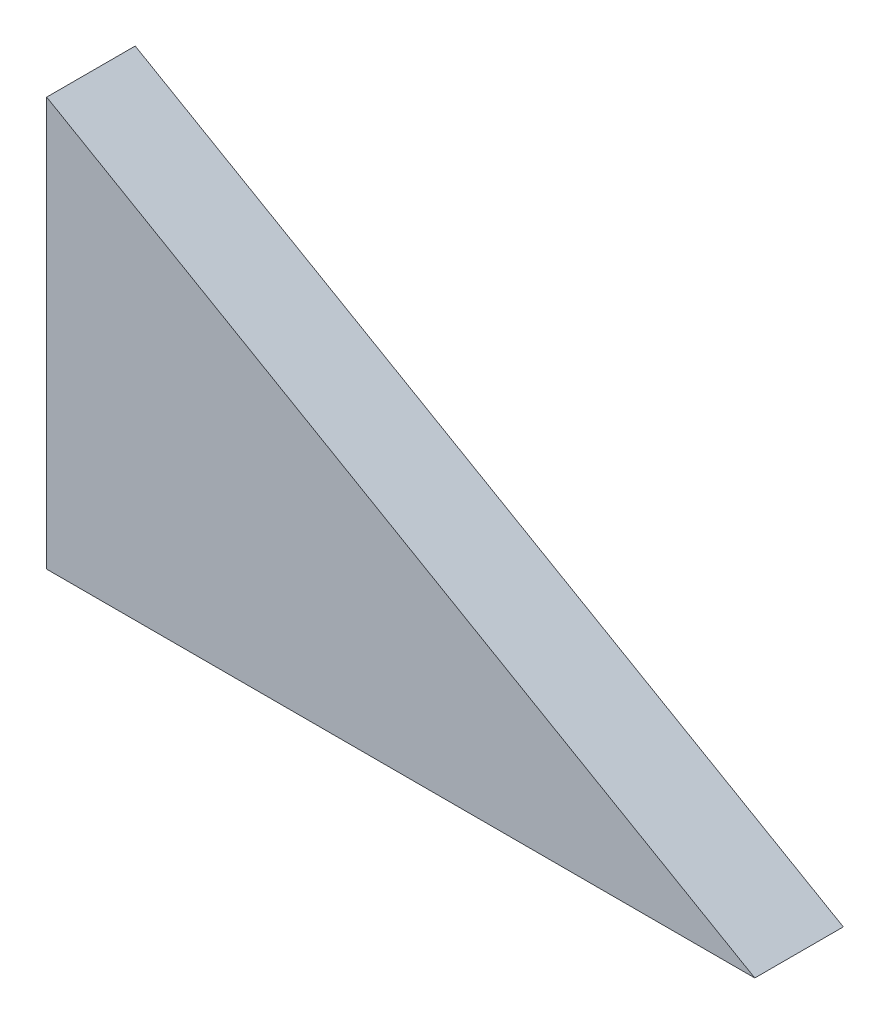
from build123d import *

# Parameters (mm, degrees)
BOSS_EXTRU_1_DEPTH = 5


with BuildPart() as part:
    # Esquisse1 → Boss.-Extru.1 (new body)
    with BuildSketch(Plane.XY):
        Polygon((0, 0), (-40, 0), (-40, 23.094010768), align=None)
    extrude(amount=BOSS_EXTRU_1_DEPTH)


solid = part.part
